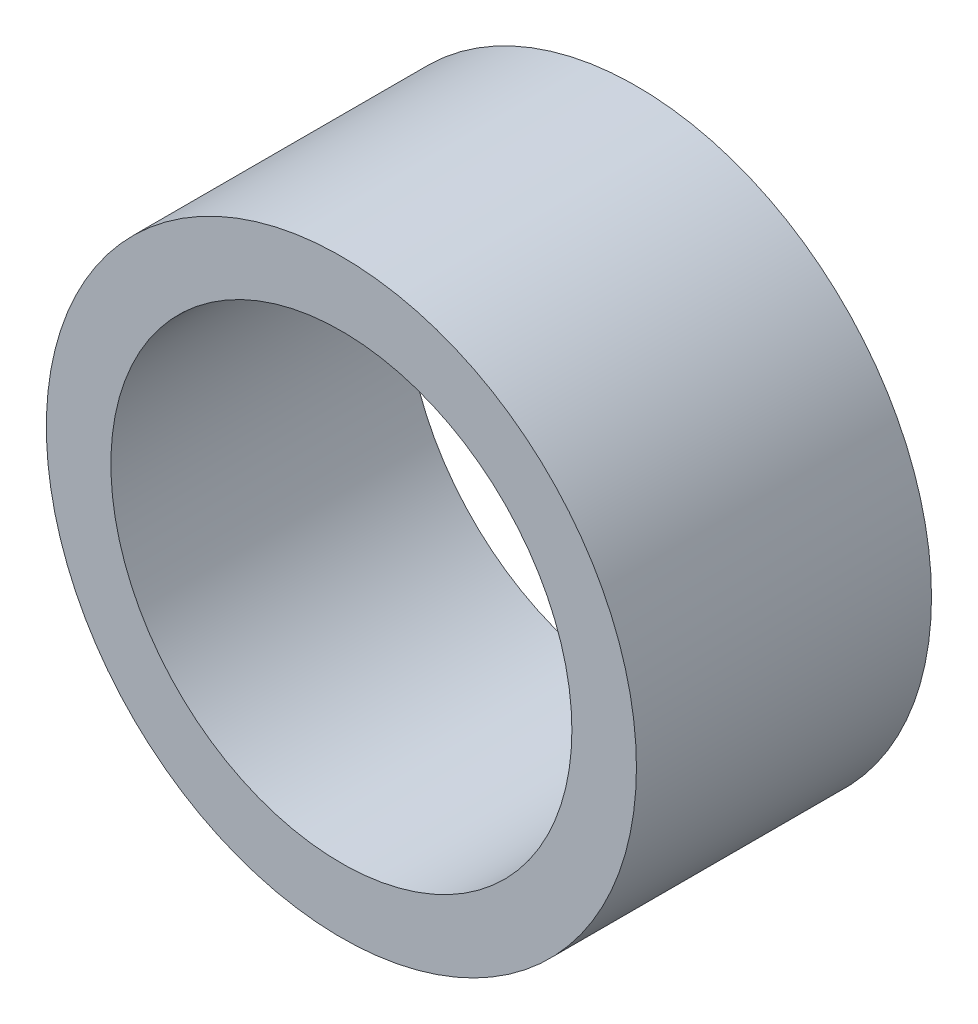
from build123d import *

# Parameters (mm, degrees)
CROQUIS1_R              = 16
CROQUIS1_R_2            = 12.5
SALIENTE_EXTRUIR1_DEPTH = 16


with BuildPart() as part:
    # Croquis1 → Saliente-Extruir1 (new body)
    with BuildSketch(Plane.XY):
        Circle(CROQUIS1_R)
        Circle(CROQUIS1_R_2, mode=Mode.SUBTRACT)
    extrude(amount=SALIENTE_EXTRUIR1_DEPTH)


solid = part.part
